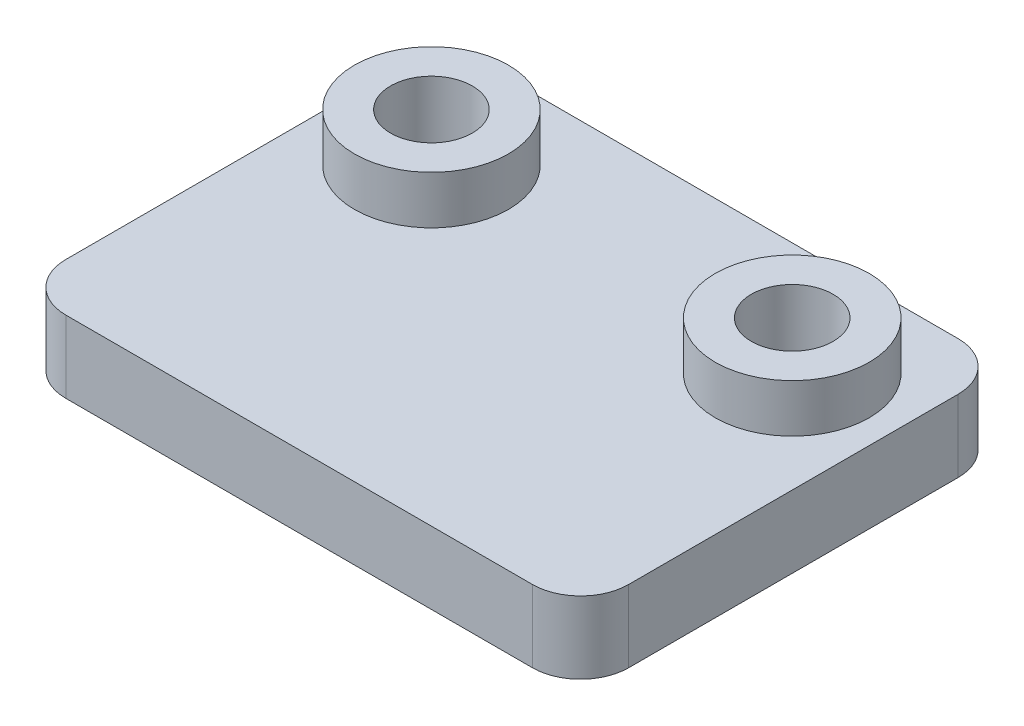
from build123d import *

# Parameters (mm, degrees)
SKETCH_1_W      = 23.4
SKETCH_1_H      = 17.7
SKETCH_1_R      = 1.7
EXTRUDE_1_DEPTH = 3
SKETCH_2_R      = 3.2
SKETCH_2_R_2    = 1.7
EXTRUDE_2_DEPTH = 2
FILLET_1_R      = 2


with BuildPart() as part:
    # Эскиз1 → Бобышка-Вытянуть1 (new body)
    with BuildSketch(Plane(origin=(0, 0, 0), x_dir=(1, 0, 0), z_dir=(0, 1, 0))):
        with Locations((0, -4.15)):
            Rectangle(SKETCH_1_W, SKETCH_1_H)
        with Locations(Location((-7.5, 0, 0), (0, 0, 270))):
            Circle(SKETCH_1_R, mode=Mode.SUBTRACT)
        with Locations(Location((7.5, 0, 0), (0, 0, 90))):
            Circle(SKETCH_1_R, mode=Mode.SUBTRACT)
    extrude(amount=EXTRUDE_1_DEPTH)

    # Эскиз2 → Бобышка-Вытянуть2 (add)
    # profile 1 of 2: a face of its own
    with BuildSketch(Plane(origin=(0, 3, 0), x_dir=(1, 0, 0), z_dir=(0, 1, 0))):
        with Locations(Location((-7.5, 0, 0), (0, 0, 270))):
            Circle(SKETCH_2_R)
        with Locations(Location((-7.5, 0, 0), (0, 0, 270))):
            Circle(SKETCH_2_R_2, mode=Mode.SUBTRACT)
    # profile 2 of 2: a face of its own
    with BuildSketch(Plane(origin=(0, 3, 0), x_dir=(1, 0, 0), z_dir=(0, 1, 0))):
        with Locations(Location((7.5, 0, 0), (0, 0, 270))):
            Circle(SKETCH_2_R)
        with Locations(Location((7.5, 0, 0), (0, 0, 90))):
            Circle(SKETCH_2_R_2, mode=Mode.SUBTRACT)
    extrude(amount=EXTRUDE_2_DEPTH)

    # Скругление1
    fillet_1_edges = [part.edges().sort_by_distance(p)[0] for p in [
        (-11.7, 1.5, -4.7),
        (11.7, 1.5, -4.7),
        (11.7, 1.5, 13),
        (-11.7, 1.5, 13),
    ]]
    fillet(fillet_1_edges, radius=FILLET_1_R)


solid = part.part
